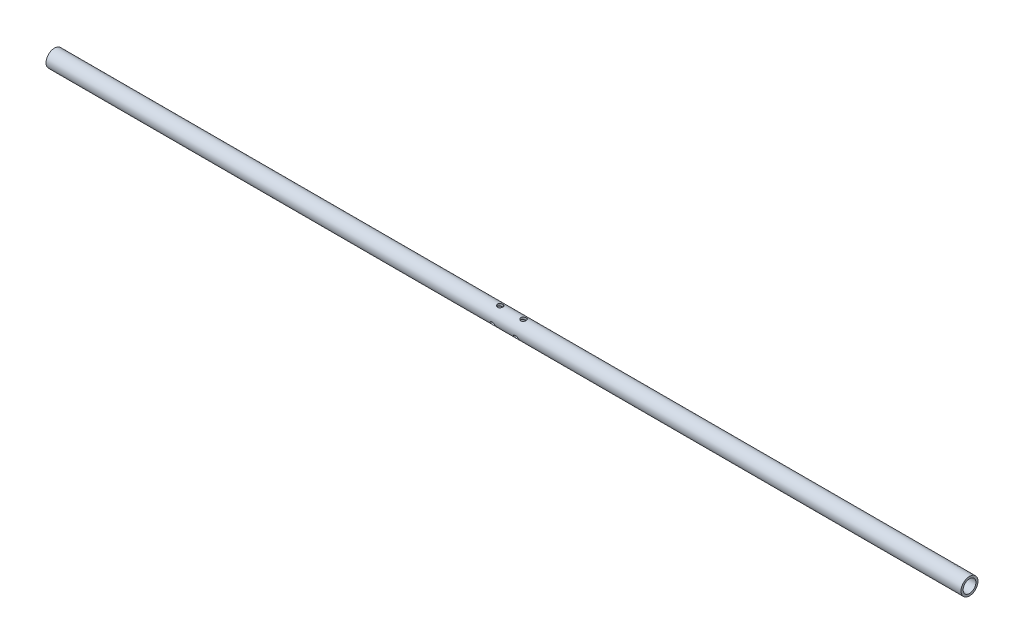
from build123d import *

# Parameters (mm, degrees)
SKETCH1_R                   = 4
SKETCH1_R_2                 = 3
EXTRUDE_THIN1_DEPTH         = 215.5
SKETCH3_W                   = 1.25
SKETCH3_H                   = 5.465467641
M3_TAPPED_HOLE1_AT_2_COUNT  = 2
M3_TAPPED_HOLE1_AT_2_PITCH  = 11
CIRPATTERN1_COUNT           = 3
CIRPATTERN1_COPY_1_SKETCH_W = 1.25
CIRPATTERN1_COPY_1_SKETCH_H = 5.465467641
CIRPATTERN1_COPY_2_SKETCH_W = 1.25
CIRPATTERN1_COPY_2_SKETCH_H = 5.465467641


with BuildPart() as part:
    # Sketch1 → Extrude-Thin1 (new, symmetric)
    with BuildSketch(Plane(origin=(0, 0, 0), x_dir=(0, 0, -1), z_dir=(1, 0, 0))):
        Circle(SKETCH1_R)
        Circle(SKETCH1_R_2, mode=Mode.SUBTRACT)
    extrude(amount=EXTRUDE_THIN1_DEPTH, both=True)

    # Sketch3 → M3 Tapped Hole1 (revolve, cut)
    with BuildSketch(Plane(origin=(-5.5, 0, 0), x_dir=(0, 0, -1), z_dir=(1, 0, 0))):
        with Locations((0.625, 2.732733821)):
            Rectangle(SKETCH3_W, SKETCH3_H)
    m3_tapped_hole1 = revolve(axis=Axis((-5.5, -6.35, 0), (0, 1, 0)), mode=Mode.SUBTRACT)

    # M3 Tapped Hole1 at 2: M3 Tapped Hole1 ×2
    with Locations(*[(i * M3_TAPPED_HOLE1_AT_2_PITCH, 0, 0) for i in range(1, M3_TAPPED_HOLE1_AT_2_COUNT)]):
        add(m3_tapped_hole1, mode=Mode.SUBTRACT)

    # CirPattern1: M3 Tapped Hole1 ×3 about axis
    cirpattern1_axis = Axis((215.5, 0, 0), (-1, 0, 0))
    for i in range(1, CIRPATTERN1_COUNT):
        add(m3_tapped_hole1.rotate(cirpattern1_axis, i * 360 / CIRPATTERN1_COUNT), mode=Mode.SUBTRACT)

    # CirPattern1 copy 1 sketch → CirPattern1 copy 1 (revolve, cut)
    with BuildSketch(Plane(origin=(5.5, 0, 0), x_dir=(0, -0.8660254037844387, 0.4999999999999998), z_dir=(1, 0, 0))):
        with Locations((0.625, 2.732733821)):
            Rectangle(CIRPATTERN1_COPY_1_SKETCH_W, CIRPATTERN1_COPY_1_SKETCH_H)
    revolve(axis=Axis((5.5, 3.175, 5.499261314), (0, -0.4999999999999998, -0.8660254037844387)), mode=Mode.SUBTRACT)

    # CirPattern1 copy 2 sketch → CirPattern1 copy 2 (revolve, cut)
    with BuildSketch(Plane(origin=(5.5, 0, 0), x_dir=(0, 0.8660254037844384, 0.5000000000000004), z_dir=(1, 0, 0))):
        with Locations((0.625, 2.732733821)):
            Rectangle(CIRPATTERN1_COPY_2_SKETCH_W, CIRPATTERN1_COPY_2_SKETCH_H)
    revolve(axis=Axis((5.5, 3.175, -5.499261314), (0, -0.5000000000000004, 0.8660254037844384)), mode=Mode.SUBTRACT)


solid = part.part
